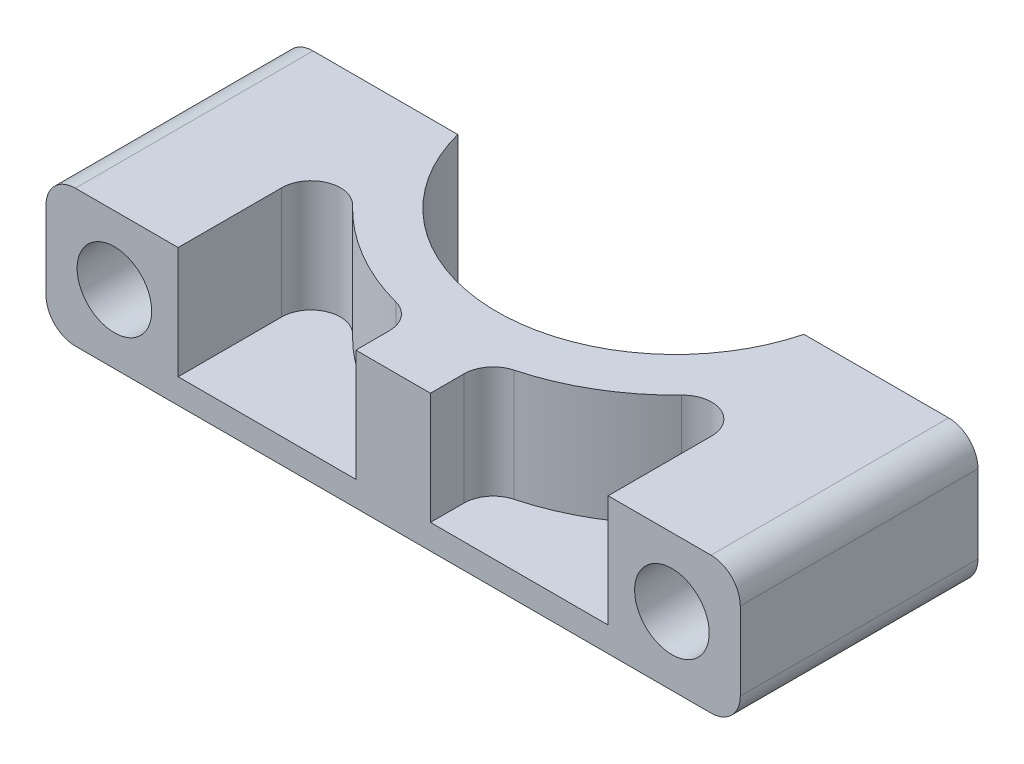
from build123d import *

# Parameters (mm, degrees)
BOSS_EXTRUDE1_DEPTH = 11
SKETCH2_R           = 3
CUT_EXTRUDE1_DEPTH  = 30
CUT_EXTRUDE3_DEPTH  = 9
FILLET2_R           = 2.36
FILLET3_R           = 2.36


with BuildPart() as part:
    # Sketch1 → Boss-Extrude1 (new body)
    with BuildSketch(Plane(origin=(0, 0, 0), x_dir=(1, 0, 0), z_dir=(0, 1, 0))):
        with BuildLine():
            Line((-27.916231576, -22.71939994), (27.916231576, -22.71939994))
            Line((27.916231576, -22.71939994), (27.916231576, -3.602655093))
            Line((27.916231576, -3.602655093), (13.916231576, -3.602655093))
            ThreePointArc((13.916231576, -3.602655093), (0, -14.375), (-13.916231576, -3.602655093))
            Line((-13.916231576, -3.602655093), (-27.916231576, -3.602655093))
            Line((-27.916231576, -3.602655093), (-27.916231576, -22.71939994))
        make_face()
    extrude(amount=BOSS_EXTRUDE1_DEPTH)

    # Sketch2 → Cut-Extrude1 (cut)
    with BuildSketch(Plane(origin=(0, 0, 3.602655093), x_dir=(-1, 0, 0), z_dir=(0, 0, -1))):
        with Locations((22.416231576, 5.5)):
            Circle(SKETCH2_R)
        with Locations((-22.416231576, 5.5)):
            Circle(SKETCH2_R)
    extrude(amount=-CUT_EXTRUDE1_DEPTH, mode=Mode.SUBTRACT)

    # Sketch3 → Cut-Extrude3 (cut)
    with BuildSketch(Plane(origin=(0, 11, 0), x_dir=(1, 0, 0), z_dir=(0, 1, 0))):
        with BuildLine():
            Line((-17.288574276, -6.224614407), (-17.288574276, -22.71939994))
            Line((-17.288574276, -22.71939994), (-3, -22.71939994))
            Line((-3, -22.71939994), (-3, -18.128447948))
            ThreePointArc((-3, -18.128447948), (-11.761457171, -14.1176751), (-17.288574276, -6.224614407))
        make_face()
        with BuildLine():
            Line((3, -18.128447948), (3, -22.71939994))
            Line((3, -22.71939994), (17.288574276, -22.71939994))
            Line((17.288574276, -22.71939994), (17.288574276, -6.224614407))
            ThreePointArc((17.288574276, -6.224614407), (11.761457171, -14.1176751), (3, -18.128447948))
        make_face()
    extrude(amount=-CUT_EXTRUDE3_DEPTH, mode=Mode.SUBTRACT)

    # Fillet2
    fillet2_edges = [part.edges().sort_by_distance(p)[0] for p in [
        (-17.288574276, 6.5, 6.224614407),
        (-3, 6.5, 18.128447948),
        (3, 6.5, 18.128447948),
        (17.288574276, 6.5, 6.224614407),
    ]]
    fillet(fillet2_edges, radius=FILLET2_R)

    # Fillet3
    fillet3_edges = [part.edges().sort_by_distance(p)[0] for p in [
        (27.916231576, 11, 13.161027516),
        (-27.916231576, 11, 13.161027516),
        (27.916231576, 0, 13.161027516),
        (-27.916231576, 0, 13.161027516),
    ]]
    fillet(fillet3_edges, radius=FILLET3_R)


solid = part.part
